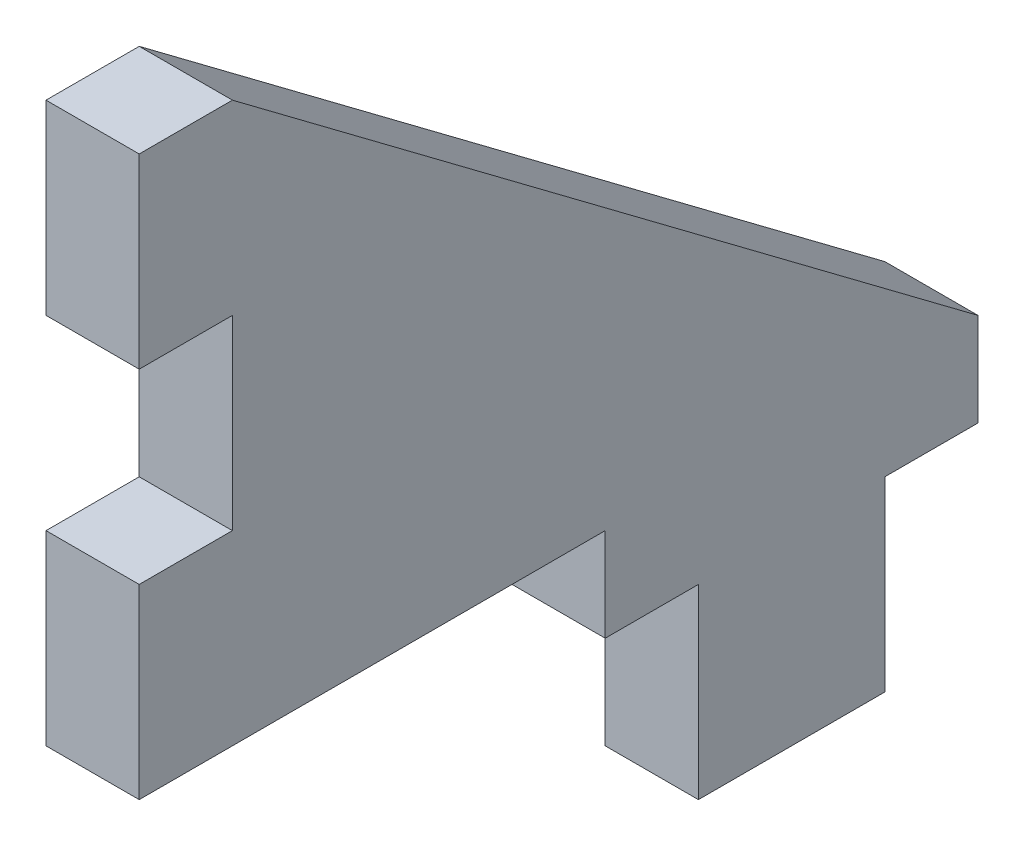
from build123d import *

# Parameters (mm, degrees)
BOSS_EXTRUDE1_DEPTH = 2.5


with BuildPart() as part:
    # Sketch2 → Boss-Extrude1 (new body)
    with BuildSketch(Plane(origin=(0, 0, 0), x_dir=(0, 0, -1), z_dir=(1, 0, 0))):
        Polygon((-8.75, 11.25), (11.25, -3.75), (11.25, -6.25), (8.75, -6.25), (8.75, -11.25), (3.75, -11.25), (3.75, -6.25), (1.25, -6.25), (1.25, -3.75), (-11.25, -3.75), (-11.25, 1.25), (-8.75, 1.25), (-8.75, 6.25), (-11.25, 6.25), (-11.25, 11.25), align=None)
    extrude(amount=BOSS_EXTRUDE1_DEPTH)


solid = part.part
